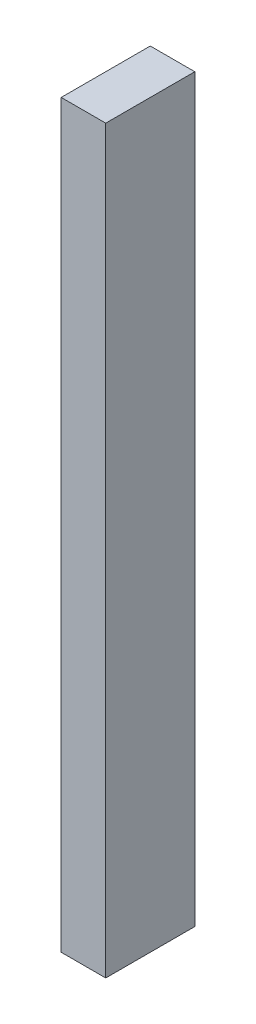
from build123d import *

# Parameters (mm, degrees)
SKETCH_1_W      = 40
SKETCH_1_H      = 332.5
EXTRUDE_1_DEPTH = 20


with BuildPart() as part:
    # Эскиз1 → Бобышка-Вытянуть1 (new body)
    with BuildSketch(Plane(origin=(0, 0, 0), x_dir=(0, 0, -1), z_dir=(1, 0, 0))):
        with Locations((385.876083199, 477.285374394)):
            Rectangle(SKETCH_1_W, SKETCH_1_H)
    extrude(amount=EXTRUDE_1_DEPTH)


solid = part.part
